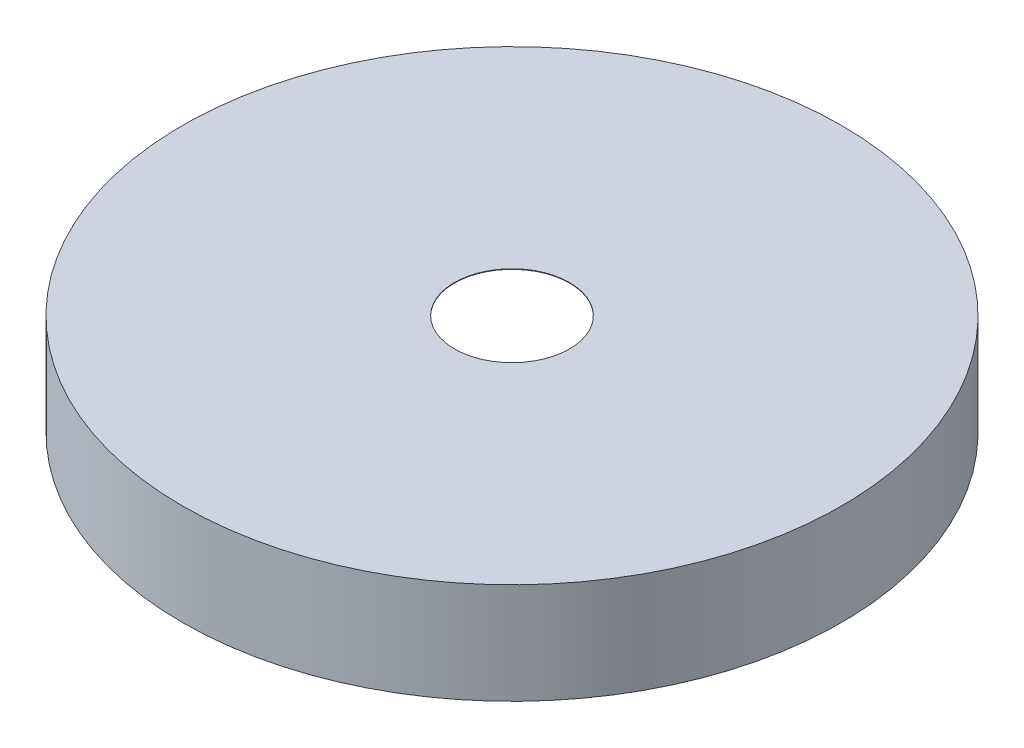
from build123d import *


with BuildPart() as part:
    # Sketch1 → Revolve1 (revolve)
    with BuildSketch(Plane.XY, mode=Mode.PRIVATE) as revolve1_sk:
        Polygon((-160.02, 0), (-160.02, 49.022), (-27.94, 49.022), (-27.94, 48.768), (-157.48, 48.768), (-157.48, 0), align=None)
    revolve(revolve1_sk.sketch.rotate(Axis((0, -2.54, 0), (0, 1, 0)), 270), axis=Axis((0, -2.54, 0), (0, 1, 0)))


solid = part.part
